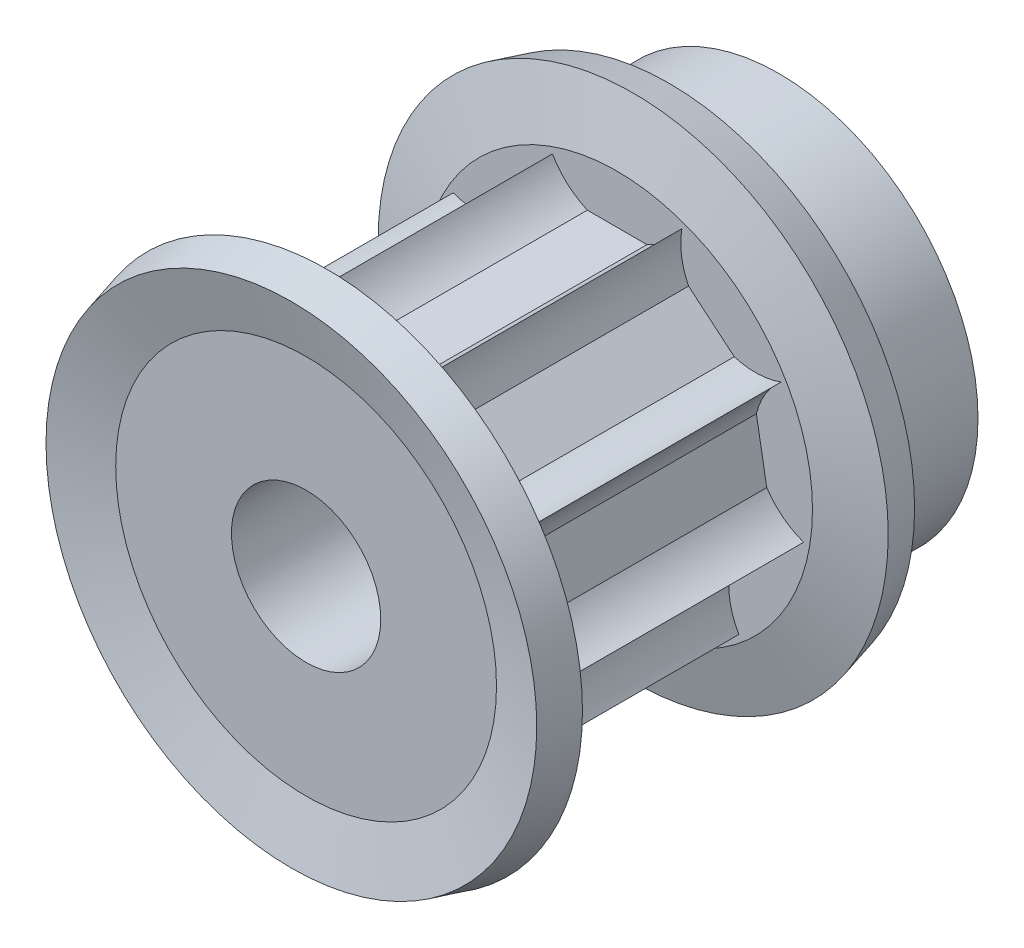
from build123d import *

# Parameters (mm, degrees)
CUT_EXTRUDE1_DEPTH = 14
CIRPATTERN17_COUNT = 9
SKETCH6_R          = 1.5
CUT_EXTRUDE2_DEPTH = 10


with BuildPart() as part:
    # Sketch1 → Revolve1 (revolve)
    with BuildSketch(Plane(origin=(0, 0, 0), x_dir=(0, 0, -1), z_dir=(1, 0, 0)), mode=Mode.PRIVATE) as revolve1_sk:
        Polygon((0, 3), (0, 10), (14, 10), (14, 8), (19, 8), (19, 3), align=None)
    revolve(revolve1_sk.sketch.rotate(Axis((0, 0, 55), (0, 0, -1)), 90), axis=Axis((0, 0, 55), (0, 0, -1)))

    # Sketch2 → Cut-Extrude1 (cut)
    with BuildSketch(Plane.XY):
        with BuildLine():
            Line((3.674262438, 8.642141394), (3.75, 8.642141394))
            Line((3.75, 8.642141394), (3.75, 10.642141394))
            Line((3.75, 10.642141394), (-3.75, 10.642141394))
            Line((-3.75, 10.642141394), (-3.75, 8.642141394))
            Line((-3.75, 8.642141394), (-3.674262438, 8.642141394))
            ThreePointArc((-3.674262438, 8.642141394), (-3.199910012, 8.473080096), (-2.93940995, 8.04211413))
            ThreePointArc((-2.93940995, 8.04211413), (-2.331794227, 6.754484031), (-1.198957881, 5.892005073))
            Line((-1.198957881, 5.892005073), (1.198957881, 5.892005073))
            ThreePointArc((1.198957881, 5.892005073), (2.331794227, 6.754484031), (2.93940995, 8.04211413))
            ThreePointArc((2.93940995, 8.04211413), (3.199910012, 8.473080096), (3.674262438, 8.642141394))
        make_face()
    cut_extrude1 = extrude(amount=-CUT_EXTRUDE1_DEPTH, mode=Mode.SUBTRACT)

    # CirPattern17: Cut-Extrude1 ×9 about axis
    cirpattern17_axis = Axis((0, 0, 0), (0, 0, 1))
    for i in range(1, CIRPATTERN17_COUNT):
        add(cut_extrude1.rotate(cirpattern17_axis, i * 360 / CIRPATTERN17_COUNT), mode=Mode.SUBTRACT)

    # Sketch3 → Revolve2 (revolve)
    with BuildSketch(Plane(origin=(0, 0, 0), x_dir=(0, 0, -1), z_dir=(1, 0, 0)), mode=Mode.PRIVATE) as revolve2_sk:
        Polygon((0, 7.651144903), (0, 3.803703196), (1.5, 3.803703196), (1.5, 7.848623649), (0.856921938, 10.248623649), (-0.591966801, 9.860395082), align=None)
        Polygon((14.591966801, 9.860395082), (13.143078062, 10.248623649), (12.5, 7.848623649), (12.5, 3.803703196), (14, 3.803703196), (14, 7.651144903), align=None)
    revolve(revolve2_sk.sketch.rotate(Axis((0, 0, 55), (0, 0, -1)), 90), axis=Axis((0, 0, 55), (0, 0, -1)))

    # Sketch6 → Cut-Extrude2 (cut)
    with BuildSketch(Plane(origin=(0, 0, 0), x_dir=(1, 0, 0), z_dir=(0, 1, 0))):
        with Locations(Location((0, 16.759840403, 0), (0, 0, 270))):
            Circle(SKETCH6_R)
    extrude(amount=-CUT_EXTRUDE2_DEPTH, mode=Mode.SUBTRACT)


solid = part.part
